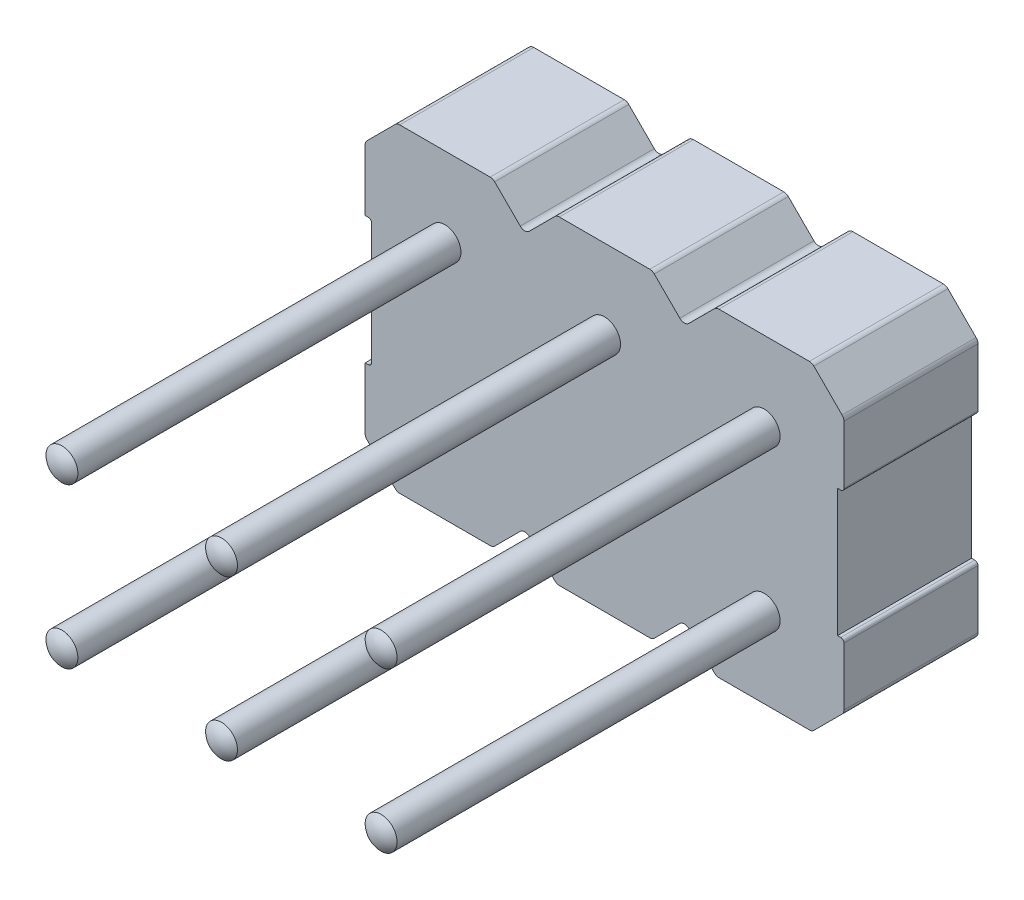
from build123d import *

# Parameters (mm, degrees)
ESQUISSE1_R                  = 0.25
BOSS_EXTRU_1_DEPTH           = 2.1
ESQUISSE2_R                  = 0.25
BOSS_EXTRU_2_DEPTH           = 6
D_ME1_FACE_RADIUS            = 0.25
D_ME1_HEIGHT                 = 0.1
R_P_TITION_LIN_AIRE2_COUNT   = 3
R_P_TITION_LIN_AIRE2_PITCH   = 2.5
R_P_TITION_LIN_AIRE2_2_COUNT = 2
R_P_TITION_LIN_AIRE2_2_PITCH = 2.5


with BuildPart() as part:
    # Esquisse1 → Boss.-Extru.1 (new body)
    with BuildSketch(Plane.XY):
        with BuildLine():
            Line((-3.208578644, -2.5), (-1.791421356, -2.5))
            ThreePointArc((-1.791421356, -2.5), (-1.753153013, -2.492387953), (-1.720710678, -2.470710678))
            Line((-1.720710678, -2.470710678), (-1.320710678, -2.070710678))
            ThreePointArc((-1.320710678, -2.070710678), (-1.25, -2.041421356), (-1.179289322, -2.070710678))
            Line((-1.179289322, -2.070710678), (-0.779289322, -2.470710678))
            ThreePointArc((-0.779289322, -2.470710678), (-0.746846987, -2.492387953), (-0.708578644, -2.5))
            Line((-0.708578644, -2.5), (0.708578644, -2.5))
            ThreePointArc((0.708578644, -2.5), (0.746846987, -2.492387953), (0.779289322, -2.470710678))
            Line((0.779289322, -2.470710678), (1.179289322, -2.070710678))
            ThreePointArc((1.179289322, -2.070710678), (1.25, -2.041421356), (1.320710678, -2.070710678))
            Line((1.320710678, -2.070710678), (1.720710678, -2.470710678))
            ThreePointArc((1.720710678, -2.470710678), (1.753153013, -2.492387953), (1.791421356, -2.5))
            Line((1.791421356, -2.5), (3.208578644, -2.5))
            ThreePointArc((3.208578644, -2.5), (3.246846987, -2.492387953), (3.279289322, -2.470710678))
            Line((3.279289322, -2.470710678), (3.720710678, -2.029289322))
            ThreePointArc((3.720710678, -2.029289322), (3.742387953, -1.996846987), (3.75, -1.958578644))
            Line((3.75, -1.958578644), (3.75, -1.05))
            ThreePointArc((3.75, -1.05), (3.735355339, -1.014644661), (3.7, -1))
            Line((3.7, -1), (3.65, -1))
            Line((3.65, -1), (3.65, 1))
            Line((3.65, 1), (3.7, 1))
            ThreePointArc((3.7, 1), (3.735355339, 1.014644661), (3.75, 1.05))
            Line((3.75, 1.05), (3.75, 1.958578644))
            ThreePointArc((3.75, 1.958578644), (3.742387953, 1.996846987), (3.720710678, 2.029289322))
            Line((3.720710678, 2.029289322), (3.279289322, 2.470710678))
            ThreePointArc((3.279289322, 2.470710678), (3.246846987, 2.492387953), (3.208578644, 2.5))
            Line((3.208578644, 2.5), (1.791421356, 2.5))
            ThreePointArc((1.791421356, 2.5), (1.753153013, 2.492387953), (1.720710678, 2.470710678))
            Line((1.720710678, 2.470710678), (1.320710678, 2.070710678))
            ThreePointArc((1.320710678, 2.070710678), (1.25, 2.041421356), (1.179289322, 2.070710678))
            Line((1.179289322, 2.070710678), (0.779289322, 2.470710678))
            ThreePointArc((0.779289322, 2.470710678), (0.746846987, 2.492387953), (0.708578644, 2.5))
            Line((0.708578644, 2.5), (-0.708578644, 2.5))
            ThreePointArc((-0.708578644, 2.5), (-0.746846987, 2.492387953), (-0.779289322, 2.470710678))
            Line((-0.779289322, 2.470710678), (-1.179289322, 2.070710678))
            ThreePointArc((-1.179289322, 2.070710678), (-1.25, 2.041421356), (-1.320710678, 2.070710678))
            Line((-1.320710678, 2.070710678), (-1.720710678, 2.470710678))
            ThreePointArc((-1.720710678, 2.470710678), (-1.753153013, 2.492387953), (-1.791421356, 2.5))
            Line((-1.791421356, 2.5), (-3.208578644, 2.5))
            ThreePointArc((-3.208578644, 2.5), (-3.246846987, 2.492387953), (-3.279289322, 2.470710678))
            Line((-3.279289322, 2.470710678), (-3.720710678, 2.029289322))
            ThreePointArc((-3.720710678, 2.029289322), (-3.742387953, 1.996846987), (-3.75, 1.958578644))
            Line((-3.75, 1.958578644), (-3.75, 1))
            Line((-3.75, 1), (-3.7, 1))
            ThreePointArc((-3.7, 1), (-3.664644661, 0.985355339), (-3.65, 0.95))
            Line((-3.65, 0.95), (-3.65, -0.95))
            ThreePointArc((-3.65, -0.95), (-3.664644661, -0.985355339), (-3.7, -1))
            Line((-3.7, -1), (-3.75, -1))
            Line((-3.75, -1), (-3.75, -1.958578644))
            ThreePointArc((-3.75, -1.958578644), (-3.742387953, -1.996846987), (-3.720710678, -2.029289322))
            Line((-3.720710678, -2.029289322), (-3.279289322, -2.470710678))
            ThreePointArc((-3.279289322, -2.470710678), (-3.246846987, -2.492387953), (-3.208578644, -2.5))
        make_face()
        with Locations((-2.5, 1.25)):
            Circle(ESQUISSE1_R, mode=Mode.SUBTRACT)
        with Locations((0, 1.25)):
            Circle(ESQUISSE1_R, mode=Mode.SUBTRACT)
        with Locations((2.5, 1.25)):
            Circle(ESQUISSE1_R, mode=Mode.SUBTRACT)
        with Locations((0, -1.25)):
            Circle(ESQUISSE1_R, mode=Mode.SUBTRACT)
        with Locations((2.5, -1.25)):
            Circle(ESQUISSE1_R, mode=Mode.SUBTRACT)
        with Locations((-2.5, -1.25)):
            Circle(ESQUISSE1_R, mode=Mode.SUBTRACT)
    extrude(amount=BOSS_EXTRU_1_DEPTH)


with BuildPart() as body_2:
    # Esquisse2 → Boss.-Extru.2 (new body)
    with BuildSketch(Plane.XY.offset(2.1)):
        with Locations((-2.5, 1.25)):
            Circle(ESQUISSE2_R)
    extrude(amount=BOSS_EXTRU_2_DEPTH)

    # Dôme1: a dome of height H over a round flat face of radius A is a cap of a sphere of radius (A * A + H * H) / (2 * H)
    d_me1_r = (D_ME1_FACE_RADIUS * D_ME1_FACE_RADIUS + D_ME1_HEIGHT * D_ME1_HEIGHT) / (2 * D_ME1_HEIGHT)
    d_me1_base = Plane((-2.5, 1.25, 8.1), z_dir=(0, 0, 1))
    with Locations(d_me1_base.offset(D_ME1_HEIGHT - d_me1_r)):
        d_me1_ball = Sphere(d_me1_r, mode=Mode.PRIVATE)
    add(split(d_me1_ball, bisect_by=d_me1_base, keep=Keep.TOP, mode=Mode.PRIVATE))


with BuildPart() as r_p_tition_lin_aire2_1:
    # Répétition linéaire2: pattern copy
    add(body_2.part.moved(Location(Vector(1, 0, 0) * (1 * R_P_TITION_LIN_AIRE2_PITCH))))


with BuildPart() as r_p_tition_lin_aire2_2:
    # Répétition linéaire2: pattern copy
    add(body_2.part.moved(Location(Vector(1, 0, 0) * (2 * R_P_TITION_LIN_AIRE2_PITCH))))


with BuildPart() as r_p_tition_lin_aire2_2_1:
    # R_p_tition lin_aire2 2: pattern copy
    add(body_2.part.moved(Location(Vector(0, -1, 0) * (1 * R_P_TITION_LIN_AIRE2_2_PITCH))))


with BuildPart() as r_p_tition_lin_aire2_2_2:
    # R_p_tition lin_aire2 2: pattern copy
    add(r_p_tition_lin_aire2_1.part.moved(Location(Vector(0, -1, 0) * (1 * R_P_TITION_LIN_AIRE2_2_PITCH))))


with BuildPart() as r_p_tition_lin_aire2_2_3:
    # R_p_tition lin_aire2 2: pattern copy
    add(r_p_tition_lin_aire2_2.part.moved(Location(Vector(0, -1, 0) * (1 * R_P_TITION_LIN_AIRE2_2_PITCH))))


solid = Compound([part.part, body_2.part, r_p_tition_lin_aire2_1.part, r_p_tition_lin_aire2_2.part, r_p_tition_lin_aire2_2_1.part, r_p_tition_lin_aire2_2_2.part, r_p_tition_lin_aire2_2_3.part])
